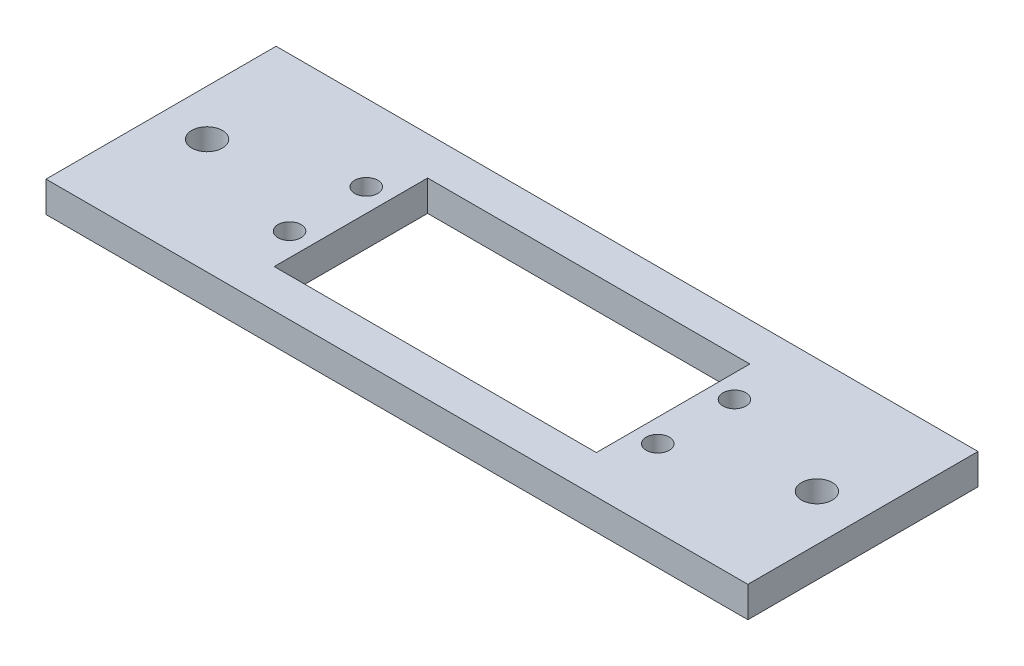
from build123d import *

# Parameters (mm, degrees)
SKETCH1_W           = 91.5
SKETCH1_H           = 30
SKETCH1_R           = 2
SKETCH1_W_2         = 42
SKETCH1_H_2         = 20
BOSS_EXTRUDE1_DEPTH = 4
SKETCH2_R           = 1.5
CUT_EXTRUDE1_DEPTH  = 49.312136156


with BuildPart() as part:
    # Sketch1 → Boss-Extrude1 (new body)
    with BuildSketch(Plane(origin=(0, 0, 0), x_dir=(1, 0, 0), z_dir=(0, 1, 0))):
        Rectangle(SKETCH1_W, SKETCH1_H)
        with Locations(Location((-39.75, 0, 0), (0, 0, 270))):
            Circle(SKETCH1_R, mode=Mode.SUBTRACT)
        with Locations(Location((39.75, 0, 0), (0, 0, 90))):
            Circle(SKETCH1_R, mode=Mode.SUBTRACT)
        Rectangle(SKETCH1_W_2, SKETCH1_H_2, mode=Mode.SUBTRACT)
    extrude(amount=BOSS_EXTRUDE1_DEPTH)

    # Sketch2 → Cut-Extrude1 (cut, through all)
    with BuildSketch(Plane(origin=(0, 4, 0), x_dir=(1, 0, 0), z_dir=(0, 1, 0))):
        with Locations(Location((-24, 5, 0), (0, 0, 270))):
            Circle(SKETCH2_R)
        with Locations(Location((-24, -5, 0), (0, 0, 90))):
            Circle(SKETCH2_R)
        with Locations(Location((24, -5, 0), (0, 0, 270))):
            Circle(SKETCH2_R)
        with Locations(Location((24, 5, 0), (0, 0, 90))):
            Circle(SKETCH2_R)
    extrude(amount=-CUT_EXTRUDE1_DEPTH, mode=Mode.SUBTRACT)


solid = part.part
